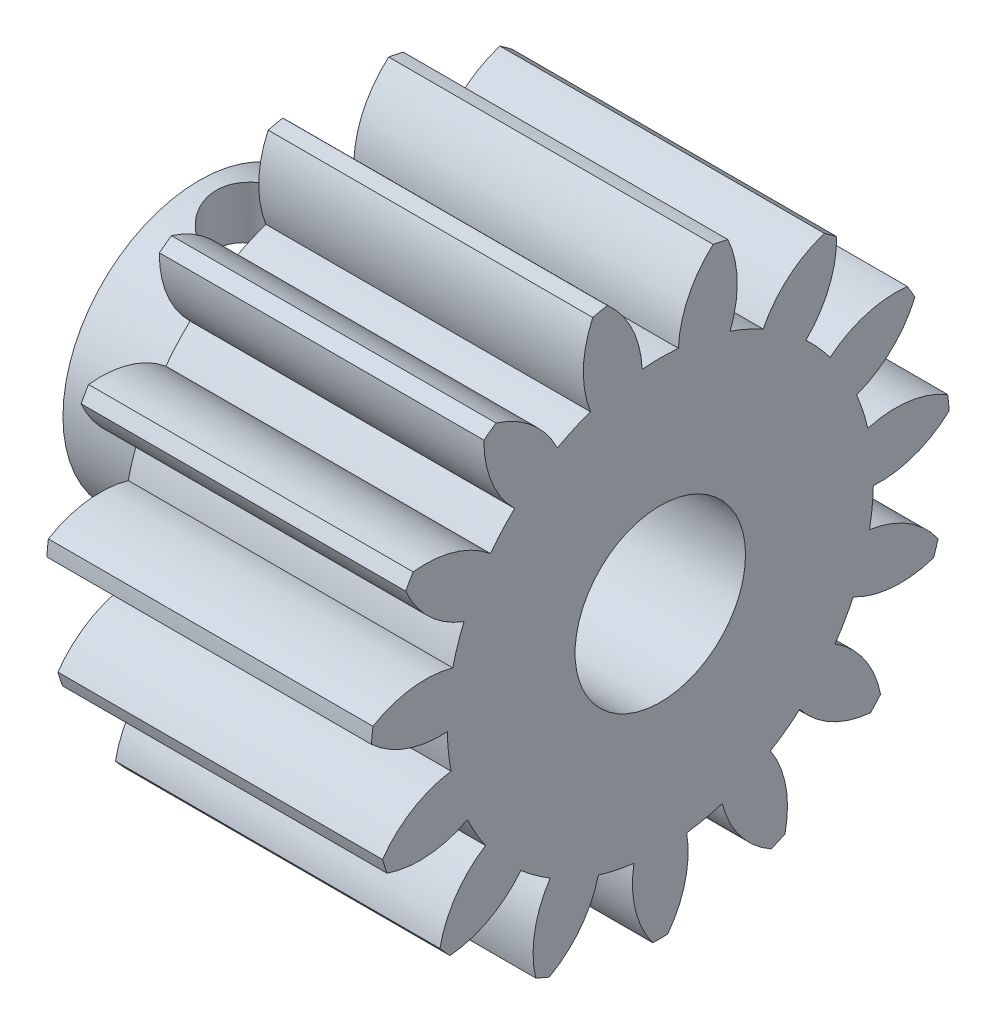
from build123d import *

# Parameters (mm, degrees)
BASPROSKE_W                = 12.7
BASPROSKE_H                = 8.5
TOOTHCUT_DEPTH             = 18.486852204
TEETHCUTS_COUNT            = 15
TEETHCUTS_ANGLE            = 336
BORSKE_R                   = 0.4
BORE_DEPTH                 = 50.0000508
CORTAR_EXTRUIR1_START      = -3.18
CORTAR_EXTRUIR1_DEPTH      = 3.18
CROQUIS4_R                 = 2.5
CORTAR_EXTRUIR2_DEPTH      = 9.52
CROQUIS5_R                 = 4
CROQUIS5_R_2               = 2.5
SALIENTE_EXTRUIR1_DEPTH    = 4
CORTAR_EXTRUIR3_DEPTH      = 16.319316842
CORTAR_EXTRUIR3_DEPTH_BACK = 16.319316842
CROQUIS6_R                 = 1.5
REDONDEO2_R                = 0.25


with BuildPart() as part:
    # BasProSke → Base-Revolve (revolve)
    with BuildSketch(Plane(origin=(0, 0, 0), x_dir=(1, 0, 0), z_dir=(0, 1, 0)), mode=Mode.PRIVATE) as base_revolve_sk:
        with Locations((6.35, 4.25)):
            Rectangle(BASPROSKE_W, BASPROSKE_H)
    revolve(base_revolve_sk.sketch.rotate(Axis((-10, 0, 0), (1, 0, 0)), 180), axis=Axis((-10, 0, 0), (1, 0, 0)))

    # TooCutSke → ToothCut (cut, through all)
    with BuildSketch(Plane(origin=(0, 0, 0), x_dir=(0, 0, -1), z_dir=(1, 0, 0))):
        with BuildLine():
            ThreePointArc((0.531576138, 6.226349477), (0, 6.249), (-0.531576138, 6.226349477))
            ThreePointArc((-0.531576138, 6.226349477), (-0.830301624, 7.411024729), (-1.576608494, 8.378350125))
            ThreePointArc((-1.576608494, 8.378350125), (0, 8.5254), (1.576608494, 8.378350125))
            ThreePointArc((1.576608494, 8.378350125), (0.830301624, 7.411024729), (0.531576138, 6.226349477))
        make_face()
    toothcut = extrude(amount=TOOTHCUT_DEPTH, mode=Mode.SUBTRACT)

    # TeethCuts: ToothCut ×15 about axis
    teethcuts_axis = Axis((-10, 0, 0), (1, 0, 0))
    for i in range(1, TEETHCUTS_COUNT):
        add(toothcut.rotate(teethcuts_axis, i * TEETHCUTS_ANGLE / (TEETHCUTS_COUNT - 1)), mode=Mode.SUBTRACT)

    # BorSke → Bore (cut, symmetric)
    with BuildSketch(Plane(origin=(0, 0, 0), x_dir=(0, 0, -1), z_dir=(1, 0, 0))):
        with Locations(Location((0, 0, 0), (0, 0, 180))):
            Circle(BORSKE_R)
    extrude(amount=BORE_DEPTH, both=True, mode=Mode.SUBTRACT)

    # Croquis2 → Cortar-Extruir1 (cut)
    with BuildSketch(Plane(origin=(12.7, 0, 0), x_dir=(0, 0, -1), z_dir=(1, 0, 0)).offset(CORTAR_EXTRUIR1_START)):
        with BuildLine():
            ThreePointArc((-8.473551116, 0.670023493), (-7.441942771, 0.04560728), (-6.24780572, -0.122166634))
            ThreePointArc((-6.24780572, -0.122166634), (-6.214767324, -0.653198367), (-6.136676046, -1.179494851))
            ThreePointArc((-6.136676046, -1.179494851), (-7.26983618, -1.591877556), (-8.149077977, -2.417132211))
            ThreePointArc((-8.149077977, -2.417132211), (-8.083980389, -2.626644452), (-8.013497238, -2.834406818))
            ThreePointArc((-8.013497238, -2.834406818), (-6.817103167, -2.985246497), (-5.657964889, -2.652816299))
            ThreePointArc((-5.657964889, -2.652816299), (-5.411792748, -3.1245), (-5.126388751, -3.573533178))
            ThreePointArc((-5.126388751, -3.573533178), (-5.993850886, -4.411161274), (-6.461416928, -5.522688773))
            ThreePointArc((-6.461416928, -5.522688773), (-6.316731017, -5.687610154), (-6.167836888, -5.84874244))
            ThreePointArc((-6.167836888, -5.84874244), (-5.013524493, -5.499924035), (-4.089810528, -4.724769925))
            ThreePointArc((-4.089810528, -4.724769925), (-3.673070042, -5.055547198), (-3.229702268, -5.349675154))
            ThreePointArc((-3.229702268, -5.349675154), (-3.681474322, -6.467715134), (-3.656518192, -7.673322273))
            ThreePointArc((-3.656518192, -7.673322273), (-3.457261466, -7.76513639), (-3.255701506, -7.851777359))
            ThreePointArc((-3.255701506, -7.851777359), (-2.343061889, -7.063614742), (-1.814490772, -5.979767908))
            ThreePointArc((-1.814490772, -5.979767908), (-1.299240156, -6.112444357), (-0.774570923, -6.200809696))
            ThreePointArc((-0.774570923, -6.200809696), (-0.732537403, -7.405942289), (-0.219374243, -8.497168643))
            ThreePointArc((-0.219374243, -8.497168643), (0, -8.5), (0.219374243, -8.497168643))
            ThreePointArc((0.219374243, -8.497168643), (0.732537403, -7.405942289), (0.774570923, -6.200809696))
            ThreePointArc((0.774570923, -6.200809696), (1.299240156, -6.112444357), (1.814490772, -5.979767908))
            ThreePointArc((1.814490772, -5.979767908), (2.343061889, -7.063614742), (3.255701506, -7.851777359))
            ThreePointArc((3.255701506, -7.851777359), (3.457261466, -7.76513639), (3.656518192, -7.673322273))
            ThreePointArc((3.656518192, -7.673322273), (3.681474322, -6.467715134), (3.229702268, -5.349675154))
            ThreePointArc((3.229702268, -5.349675154), (3.673070042, -5.055547198), (4.089810528, -4.724769925))
            ThreePointArc((4.089810528, -4.724769925), (5.013524493, -5.499924035), (6.167836888, -5.84874244))
            ThreePointArc((6.167836888, -5.84874244), (6.316731017, -5.687610154), (6.461416928, -5.522688773))
            ThreePointArc((6.461416928, -5.522688773), (5.993850886, -4.411161274), (5.126388751, -3.573533178))
            ThreePointArc((5.126388751, -3.573533178), (5.411792748, -3.1245), (5.657964889, -2.652816299))
            ThreePointArc((5.657964889, -2.652816299), (6.817103167, -2.985246497), (8.013497238, -2.834406818))
            ThreePointArc((8.013497238, -2.834406818), (8.083980389, -2.626644452), (8.149077977, -2.417132211))
            ThreePointArc((8.149077977, -2.417132211), (7.26983618, -1.591877556), (6.136676046, -1.179494851))
            ThreePointArc((6.136676046, -1.179494851), (6.214767324, -0.653198367), (6.24780572, -0.122166634))
            ThreePointArc((6.24780572, -0.122166634), (7.441942771, 0.04560728), (8.473551116, 0.670023493))
            ThreePointArc((8.473551116, 0.670023493), (8.453436111, 0.888491938), (8.427689411, 1.106368468))
            ThreePointArc((8.427689411, 1.106368468), (7.288800753, 1.502656253), (6.085876303, 1.418488851))
            ThreePointArc((6.085876303, 1.418488851), (5.94315217, 1.931047198), (5.757344182, 2.429606752))
            ThreePointArc((5.757344182, 2.429606752), (6.780002862, 3.068575145), (7.468451026, 4.058600654))
            ThreePointArc((7.468451026, 4.058600654), (7.361215932, 4.25), (7.249076783, 4.438567989))
            ThreePointArc((7.249076783, 4.438567989), (6.04746546, 4.337367144), (4.982773259, 3.771202944))
            ThreePointArc((4.982773259, 3.771202944), (4.643912014, 4.181397159), (4.271385532, 4.561279057))
            ThreePointArc((4.271385532, 4.561279057), (4.945738865, 5.560958489), (5.171987905, 6.745408891))
            ThreePointArc((5.171987905, 6.745408891), (4.996174644, 6.876644452), (4.817032924, 7.003298781))
            ThreePointArc((4.817032924, 7.003298781), (3.760468449, 6.422107853), (3.018103451, 5.471841788))
            ThreePointArc((3.018103451, 5.471841788), (2.541697283, 5.708745565), (2.046865518, 5.904264776))
            ThreePointArc((2.046865518, 5.904264776), (2.256311686, 7.091801591), (1.981241089, 8.265874651))
            ThreePointArc((1.981241089, 8.265874651), (1.767249372, 8.314254606), (1.55208031, 8.357095591))
            ThreePointArc((1.55208031, 8.357095591), (0.823252281, 7.396407771), (0.531576138, 6.226349477))
            ThreePointArc((0.531576138, 6.226349477), (0, 6.249), (-0.531576138, 6.226349477))
            ThreePointArc((-0.531576138, 6.226349477), (-0.823252281, 7.396407771), (-1.55208031, 8.357095591))
            ThreePointArc((-1.55208031, 8.357095591), (-1.767249372, 8.314254606), (-1.981241089, 8.265874651))
            ThreePointArc((-1.981241089, 8.265874651), (-2.256311686, 7.091801591), (-2.046865518, 5.904264776))
            ThreePointArc((-2.046865518, 5.904264776), (-2.541697283, 5.708745565), (-3.018103451, 5.471841788))
            ThreePointArc((-3.018103451, 5.471841788), (-3.760468449, 6.422107853), (-4.817032924, 7.003298781))
            ThreePointArc((-4.817032924, 7.003298781), (-4.996174644, 6.876644452), (-5.171987905, 6.745408891))
            ThreePointArc((-5.171987905, 6.745408891), (-4.945738865, 5.560958489), (-4.271385532, 4.561279057))
            ThreePointArc((-4.271385532, 4.561279057), (-4.643912014, 4.181397159), (-4.982773259, 3.771202944))
            ThreePointArc((-4.982773259, 3.771202944), (-6.04746546, 4.337367144), (-7.249076783, 4.438567989))
            ThreePointArc((-7.249076783, 4.438567989), (-7.361215932, 4.25), (-7.468451026, 4.058600654))
            ThreePointArc((-7.468451026, 4.058600654), (-6.780002862, 3.068575145), (-5.757344182, 2.429606752))
            ThreePointArc((-5.757344182, 2.429606752), (-5.94315217, 1.931047198), (-6.085876303, 1.418488851))
            ThreePointArc((-6.085876303, 1.418488851), (-7.288800753, 1.502656253), (-8.427689411, 1.106368468))
            ThreePointArc((-8.427689411, 1.106368468), (-8.453436111, 0.888491938), (-8.473551116, 0.670023493))
        make_face()
    extrude(amount=CORTAR_EXTRUIR1_DEPTH, mode=Mode.SUBTRACT)

    # Croquis4 → Cortar-Extruir2 (cut)
    with BuildSketch(Plane(origin=(9.52, 0, 0), x_dir=(0, 0, -1), z_dir=(1, 0, 0))):
        Circle(CROQUIS4_R)
    extrude(amount=-CORTAR_EXTRUIR2_DEPTH, mode=Mode.SUBTRACT)

    # Croquis5 → Saliente-Extruir1 (add)
    with BuildSketch(Plane.ZY):
        with Locations(Location((0, 0, 0), (0, 0, 180))):
            Circle(CROQUIS5_R)
        with Locations(Location((0, 0, 0), (0, 0, 180))):
            Circle(CROQUIS5_R_2, mode=Mode.SUBTRACT)
    extrude(amount=SALIENTE_EXTRUIR1_DEPTH)

    # Croquis6 → Cortar-Extruir3 (cut, two sides: drawn at the far end of the back side and taken through both)
    with BuildSketch(Plane(origin=(0, 0, 0), x_dir=(1, 0, 0), z_dir=(0, 1, 0)).offset(-CORTAR_EXTRUIR3_DEPTH_BACK)):
        with Locations(Location((-2, 0, 0), (0, 0, 270))):
            Circle(CROQUIS6_R)
    extrude(amount=CORTAR_EXTRUIR3_DEPTH + CORTAR_EXTRUIR3_DEPTH_BACK, mode=Mode.SUBTRACT)

    # Redondeo2
    redondeo2_edges = [part.edges().sort_by_distance(p)[0] for p in [
        (0, 0, 4),
    ]]
    fillet(redondeo2_edges, radius=REDONDEO2_R)


solid = part.part
